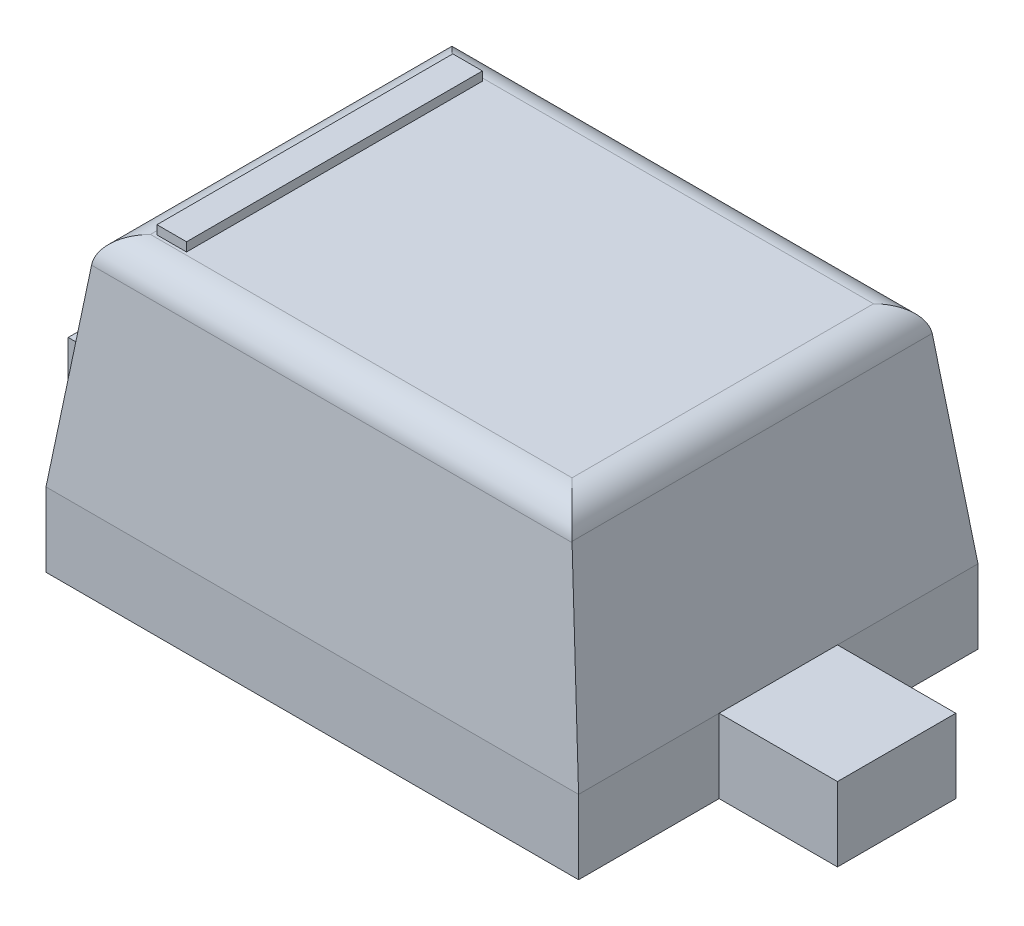
from build123d import *

# Parameters (mm, degrees)
SKETCH_1_W        = 1.8
SKETCH_1_H        = 1.35
EXTRUDE_1_DEPTH   = 0.25
SKETCH_2_W        = 0.8
SKETCH_2_H        = 0.4
EXTRUDE_2_DEPTH   = 0.25
EXTRUDE_2_2_DEPTH = 0.25
SKETCH_2_2_W      = 0.8
SKETCH_2_2_H      = 0.4
EXTRUDE_3_DEPTH   = 0.25
EXTRUDE_3_2_DEPTH = 0.25
SKETCH_5_W        = 0.1
SKETCH_5_H        = 1
EXTRUDE_4_DEPTH   = 0.03
FILLET_1_R        = 0.1


with BuildPart() as part:
    # Эскиз1 → Бобышка-Вытянуть1 (new body)
    with BuildSketch(Plane(origin=(0, 0, 0), x_dir=(1, 0, 0), z_dir=(0, 1, 0))):
        Rectangle(SKETCH_1_W, SKETCH_1_H)
    extrude(amount=EXTRUDE_1_DEPTH)


with BuildPart() as body_2:
    # Эскиз2 → Бобышка-Вытянуть2 (new body)
    with BuildSketch(Plane(origin=(0, 0, 0), x_dir=(1, 0, 0), z_dir=(0, 1, 0))):
        with Locations((0.9, 0)):
            Rectangle(SKETCH_2_W, SKETCH_2_H)
    extrude(amount=EXTRUDE_2_DEPTH)


with BuildPart() as body_3:
    # Эскиз2 → Extrude 2 2 (new body)
    with BuildSketch(Plane(origin=(0, 0, 0), x_dir=(1, 0, 0), z_dir=(0, 1, 0))):
        with Locations((-0.9, 0)):
            Rectangle(SKETCH_2_W, SKETCH_2_H)
    extrude(amount=EXTRUDE_2_2_DEPTH)


with BuildPart() as part_1:
    add(part.part)

    # Combine 1: cut body 3, body 2
    add(body_3.part, mode=Mode.SUBTRACT)
    add(body_2.part, mode=Mode.SUBTRACT)


with BuildPart() as body_2_2:
    # Эскиз2<2> → Бобышка-Вытянуть3 (new body)
    with BuildSketch(Plane(origin=(0, 0, 0), x_dir=(1, 0, 0), z_dir=(0, 1, 0))):
        with Locations((0.9, 0)):
            Rectangle(SKETCH_2_2_W, SKETCH_2_2_H)
    extrude(amount=EXTRUDE_3_DEPTH)


with BuildPart() as body_3_2:
    # Эскиз2<2> → Extrude 3 2 (new body)
    with BuildSketch(Plane(origin=(0, 0, 0), x_dir=(1, 0, 0), z_dir=(0, 1, 0))):
        with Locations((-0.9, 0)):
            Rectangle(SKETCH_2_2_W, SKETCH_2_2_H)
    extrude(amount=EXTRUDE_3_2_DEPTH)


with BuildPart() as body_4:
    # Эскиз3 → По сечениям1 section 0
    with BuildSketch(Plane(origin=(0, 0.25, 0), x_dir=(1, 0, 0), z_dir=(0, 1, 0))):
        with BuildLine():
            Line((0.9, -0.675), (-0.9, -0.675))
            Line((-0.9, -0.675), (-0.9, 0.675))
            Line((-0.9, 0.675), (0.9, 0.675))
            Line((0.9, 0.675), (0.9, -0.675))
        make_face()
    # Эскиз4 → По сечениям1 section 1
    with BuildSketch(Plane(origin=(0, 1, 0), x_dir=(1, 0, 0), z_dir=(0, 1, 0))):
        with BuildLine():
            Line((0.8, -0.6), (-0.8, -0.6))
            Line((-0.8, -0.6), (-0.8, 0.6))
            Line((-0.8, 0.6), (0.8, 0.6))
            Line((0.8, 0.6), (0.8, -0.6))
        make_face()
    loft()

    # Скругление1
    fillet_1_edges = [body_4.edges().sort_by_distance(p)[0] for p in [
        (0, 1, -0.6),
        (0.8, 1, 0),
        (0, 1, 0.6),
        (-0.8, 1, 0),
    ]]
    fillet(fillet_1_edges, radius=FILLET_1_R)


with BuildPart() as body_5:
    # Эскиз5 → Бобышка-Вытянуть4 (new body)
    with BuildSketch(Plane(origin=(0, 1, 0), x_dir=(1, 0, 0), z_dir=(0, 1, 0))):
        with Locations((-0.65, 0)):
            Rectangle(SKETCH_5_W, SKETCH_5_H)
    extrude(amount=EXTRUDE_4_DEPTH)


solid = Compound([part_1.part, body_2_2.part, body_3_2.part, body_4.part, body_5.part])
